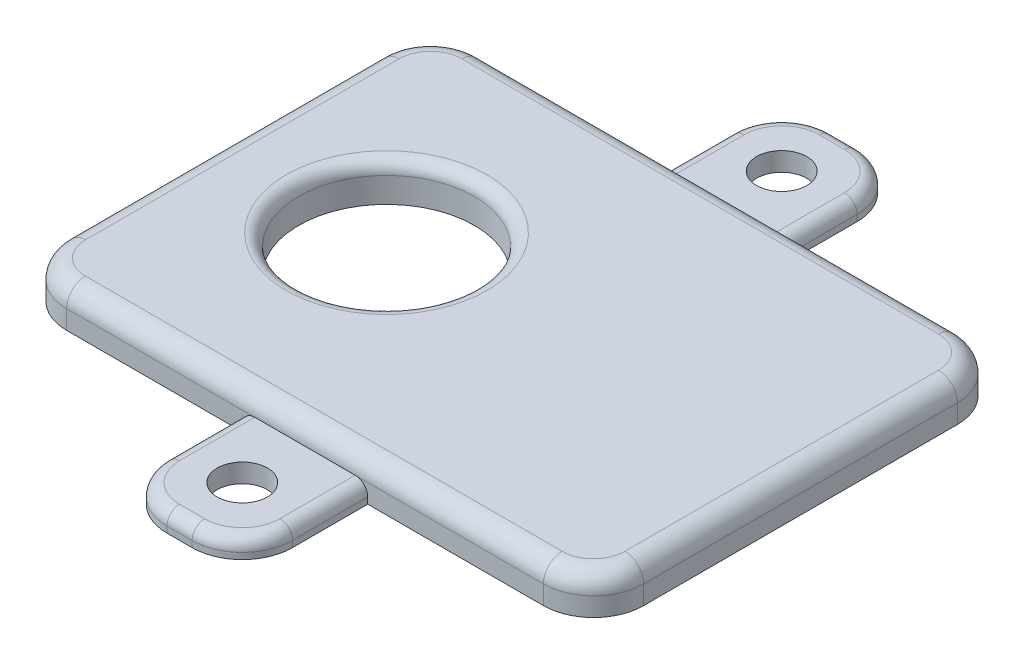
from build123d import *

# Parameters (mm, degrees)
BASE_W             = 46
BASE_H             = 33
SHELL_DEPTH        = 3
SKETCH2_W          = 10
SKETCH2_H          = 1.5
LEG_DEPTH          = 10
SKETCH3_R          = 2
CUT_EXTRUDE1_DEPTH = 10
FILLET1_R          = 4
SKETCH4_R          = 7
CUT_EXTRUDE2_DEPTH = 10
FILLET2_R          = 1
FILLET3_R          = 4
FILLET10_R         = 1.5
FILLET11_R         = 1
FILLET12_R         = 1


with BuildPart() as part:
    # Base → Shell (new body)
    with BuildSketch(Plane(origin=(0, 0, 0), x_dir=(1, 0, 0), z_dir=(0, 1, 0))):
        Rectangle(BASE_W, BASE_H)
    extrude(amount=SHELL_DEPTH)

    # Sketch4 → Cut-Extrude2 (cut)
    with BuildSketch(Plane(origin=(0, 3, 0), x_dir=(1, 0, 0), z_dir=(0, 1, 0))):
        with Locations(Location((-10, 0, 0), (0, 0, 270))):
            Circle(SKETCH4_R)
    extrude(amount=-CUT_EXTRUDE2_DEPTH, mode=Mode.SUBTRACT)

    # Fillet2
    fillet2_edges = [part.edges().sort_by_distance(p)[0] for p in [
        (-10, 3, -7),
    ]]
    fillet(fillet2_edges, radius=FILLET2_R)

    # Fillet3
    fillet3_edges = [part.edges().sort_by_distance(p)[0] for p in [
        (23, 1.5, 16.5),
        (-23, 1.5, 16.5),
        (-23, 1.5, -16.5),
        (23, 1.5, -16.5),
    ]]
    fillet(fillet3_edges, radius=FILLET3_R)

    # Fillet10
    fillet10_edges = [part.edges().sort_by_distance(p)[0] for p in [
        (23, 3, 0),
        (0, 3, 16.5),
        (0, 3, -16.5),
        (-23, 3, 0),
        (-21.828427125, 3, 15.328427125),
        (-21.828427125, 3, -15.328427125),
        (21.828427125, 3, -15.328427125),
        (21.828427125, 3, 15.328427125),
    ]]
    fillet(fillet10_edges, radius=FILLET10_R)


with BuildPart() as body_2:
    # Sketch2 → Leg (new body)
    with BuildSketch(Plane.XY.offset(16.5)):
        with Locations((0, 0.75)):
            Rectangle(SKETCH2_W, SKETCH2_H)
    extrude(amount=LEG_DEPTH)

    # Sketch3 → Cut-Extrude1 (cut)
    with BuildSketch(Plane(origin=(0, 3, 0), x_dir=(1, 0, 0), z_dir=(0, 1, 0))):
        with Locations(Location((0, -21.5, 0), (0, 0, 180))):
            Circle(SKETCH3_R)
    extrude(amount=-CUT_EXTRUDE1_DEPTH, mode=Mode.SUBTRACT)

    # Fillet1
    fillet1_edges = [body_2.edges().sort_by_distance(p)[0] for p in [
        (-5, 0.75, 26.5),
        (5, 0.75, 26.5),
    ]]
    fillet(fillet1_edges, radius=FILLET1_R)


with BuildPart() as body_3:
    # Mirror3: mirrored copy
    add(body_2.part.mirror(Plane.XY))

    # Fillet12
    fillet12_edges = [body_3.edges().sort_by_distance(p)[0] for p in [
        (0, 1.5, -26.5),
        (-5, 1.5, -19.5),
        (5, 1.5, -19.5),
        (3.828427125, 1.5, -25.328427125),
        (-3.828427125, 1.5, -25.328427125),
    ]]
    fillet(fillet12_edges, radius=FILLET12_R)


with BuildPart() as body_2_1:
    add(body_2.part)

    # Fillet11
    fillet11_edges = [body_2_1.edges().sort_by_distance(p)[0] for p in [
        (0, 1.5, 26.5),
        (-5, 1.5, 19.5),
        (5, 1.5, 19.5),
        (3.828427125, 1.5, 25.328427125),
        (-3.828427125, 1.5, 25.328427125),
    ]]
    fillet(fillet11_edges, radius=FILLET11_R)


solid = Compound([part.part, body_3.part, body_2_1.part])
